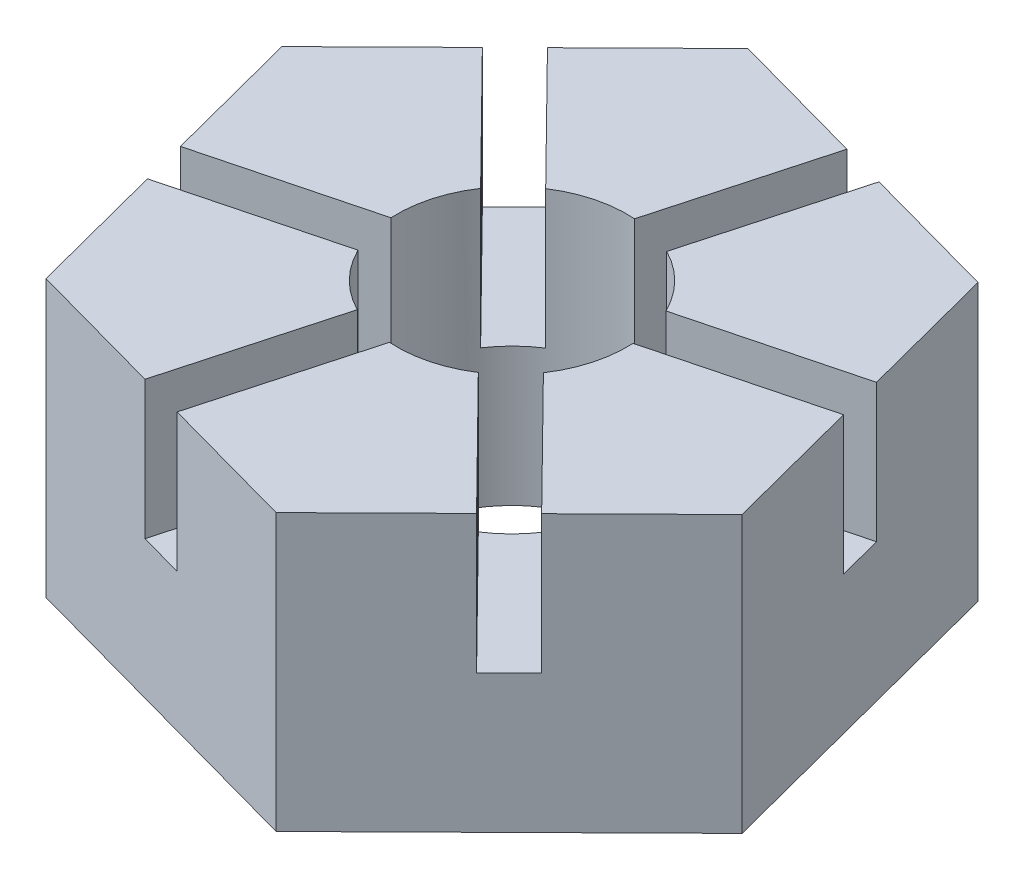
from build123d import *

# Parameters (mm, degrees)
BOSS_EXTRUDE1_DEPTH   = 60
BOSS_EXTRUDE1_2_DEPTH = 60
BOSS_EXTRUDE1_3_DEPTH = 60
BOSS_EXTRUDE1_4_DEPTH = 60
BOSS_EXTRUDE1_5_DEPTH = 60
BOSS_EXTRUDE1_6_DEPTH = 60
BOSS_EXTRUDE2_DEPTH   = 30


with BuildPart() as part:
    # Sketch2 → Boss-Extrude1 (new body)
    with BuildSketch(Plane(origin=(0, 0, 0), x_dir=(1, 0, 0), z_dir=(0, 1, 0))):
        with BuildLine():
            Line((22.445988761, 11.008069246), (58.740707334, 20.453692353))
            Line((58.740707334, 20.453692353), (50.984749422, 50.255888195))
            Line((50.984749422, 50.255888195), (21.297311778, 58.440129534))
            Line((21.297311778, 58.440129534), (11.330102056, 22.285169674))
            ThreePointArc((11.330102056, 22.285169674), (17.804474894, 17.54994797), (22.445988761, 11.008069246))
        make_face()
    extrude(amount=BOSS_EXTRUDE1_DEPTH)



with BuildPart() as body_2:
    # Sketch2 → Boss-Extrude1 2 (new body)
    with BuildSketch(Plane(origin=(0, 0, 0), x_dir=(1, 0, 0), z_dir=(0, 1, 0))):
        with BuildLine():
            Line((69.015250578, -19.026144108), (61.259292666, 10.776051735))
            Line((61.259292666, 10.776051735), (24.964574093, 1.330428629))
            ThreePointArc((24.964574093, 1.330428629), (24.100938224, -6.644153574), (20.756261995, -13.934761857))
            Line((20.756261995, -13.934761857), (47.083770846, -40.644098611))
            Line((47.083770846, -40.644098611), (69.015250578, -19.026144108))
        make_face()
    extrude(amount=BOSS_EXTRUDE1_2_DEPTH)


with BuildPart() as body_3:
    # Sketch2 → Boss-Extrude1 3 (new body)
    with BuildSketch(Plane(origin=(0, 0, 0), x_dir=(1, 0, 0), z_dir=(0, 1, 0))):
        with BuildLine():
            ThreePointArc((-13.634472037, 20.954741045), (-6.29646333, 24.194101544), (1.689726767, 24.942831103))
            Line((1.689726767, 24.942831103), (11.656936488, 61.097790964))
            Line((11.656936488, 61.097790964), (-18.030501156, 69.282032303))
            Line((-18.030501156, 69.282032303), (-39.961980888, 47.664077799))
            Line((-39.961980888, 47.664077799), (-13.634472037, 20.954741045))
        make_face()
    extrude(amount=BOSS_EXTRUDE1_3_DEPTH)


with BuildPart() as body_4:
    # Sketch2 → Boss-Extrude1 4 (new body)
    with BuildSketch(Plane(origin=(0, 0, 0), x_dir=(1, 0, 0), z_dir=(0, 1, 0))):
        with BuildLine():
            Line((18.030501156, -69.282032303), (39.961980888, -47.664077799))
            Line((39.961980888, -47.664077799), (13.634472037, -20.954741045))
            ThreePointArc((13.634472037, -20.954741045), (6.29646333, -24.194101544), (-1.689726767, -24.942831103))
            Line((-1.689726767, -24.942831103), (-11.656936488, -61.097790964))
            Line((-11.656936488, -61.097790964), (18.030501156, -69.282032303))
        make_face()
    extrude(amount=BOSS_EXTRUDE1_4_DEPTH)


with BuildPart() as body_5:
    # Sketch2 → Boss-Extrude1 5 (new body)
    with BuildSketch(Plane(origin=(0, 0, 0), x_dir=(1, 0, 0), z_dir=(0, 1, 0))):
        with BuildLine():
            ThreePointArc((-24.964574093, -1.330428629), (-24.100938224, 6.644153574), (-20.756261995, 13.934761857))
            Line((-20.756261995, 13.934761857), (-47.083770846, 40.644098611))
            Line((-47.083770846, 40.644098611), (-69.015250578, 19.026144108))
            Line((-69.015250578, 19.026144108), (-61.259292666, -10.776051735))
            Line((-61.259292666, -10.776051735), (-24.964574093, -1.330428629))
        make_face()
    extrude(amount=BOSS_EXTRUDE1_5_DEPTH)


with BuildPart() as body_6:
    # Sketch2 → Boss-Extrude1 6 (new body)
    with BuildSketch(Plane(origin=(0, 0, 0), x_dir=(1, 0, 0), z_dir=(0, 1, 0))):
        with BuildLine():
            Line((-21.297311778, -58.440129534), (-11.330102056, -22.285169674))
            ThreePointArc((-11.330102056, -22.285169674), (-17.804474894, -17.54994797), (-22.445988761, -11.008069246))
            Line((-22.445988761, -11.008069246), (-58.740707334, -20.453692353))
            Line((-58.740707334, -20.453692353), (-50.984749422, -50.255888195))
            Line((-50.984749422, -50.255888195), (-21.297311778, -58.440129534))
        make_face()
    extrude(amount=BOSS_EXTRUDE1_6_DEPTH)


with BuildPart() as part_1:
    add(part.part)

    add(body_2.part)  # Boss-Extrude2 merges body 2

    add(body_3.part)  # Boss-Extrude2 merges body 3

    add(body_4.part)  # Boss-Extrude2 merges body 4

    add(body_5.part)  # Boss-Extrude2 merges body 5

    add(body_6.part)  # Boss-Extrude2 merges body 6
    # Sketch2<3> → Boss-Extrude2 (add)
    with BuildSketch(Plane(origin=(0, 0, 0), x_dir=(1, 0, 0), z_dir=(0, 1, 0))):
        with BuildLine():
            Line((61.259292666, 10.776051735), (58.740707334, 20.453692353))
            Line((58.740707334, 20.453692353), (22.445988761, 11.008069246))
            ThreePointArc((22.445988761, 11.008069246), (24.194101544, 6.29646333), (24.964574093, 1.330428629))
            Line((24.964574093, 1.330428629), (61.259292666, 10.776051735))
        make_face()
        with BuildLine():
            ThreePointArc((1.689726767, 24.942831103), (6.644153574, 24.100938224), (11.330102056, 22.285169674))
            Line((11.330102056, 22.285169674), (21.297311778, 58.440129534))
            Line((21.297311778, 58.440129534), (11.656936488, 61.097790964))
            Line((11.656936488, 61.097790964), (1.689726767, 24.942831103))
        make_face()
        with BuildLine():
            Line((39.961980888, -47.664077799), (47.083770846, -40.644098611))
            Line((47.083770846, -40.644098611), (20.756261995, -13.934761857))
            ThreePointArc((20.756261995, -13.934761857), (17.54994797, -17.804474894), (13.634472037, -20.954741045))
            Line((13.634472037, -20.954741045), (39.961980888, -47.664077799))
        make_face()
        with BuildLine():
            ThreePointArc((-20.756261995, 13.934761857), (-17.54994797, 17.804474894), (-13.634472037, 20.954741045))
            Line((-13.634472037, 20.954741045), (-39.961980888, 47.664077799))
            Line((-39.961980888, 47.664077799), (-47.083770846, 40.644098611))
            Line((-47.083770846, 40.644098611), (-20.756261995, 13.934761857))
        make_face()
        with BuildLine():
            Line((-11.656936488, -61.097790964), (-1.689726767, -24.942831103))
            ThreePointArc((-1.689726767, -24.942831103), (-6.644153574, -24.100938224), (-11.330102056, -22.285169674))
            Line((-11.330102056, -22.285169674), (-21.297311778, -58.440129534))
            Line((-21.297311778, -58.440129534), (-11.656936488, -61.097790964))
        make_face()
        with BuildLine():
            ThreePointArc((-22.445988761, -11.008069246), (-24.194101544, -6.29646333), (-24.964574093, -1.330428629))
            Line((-24.964574093, -1.330428629), (-61.259292666, -10.776051735))
            Line((-61.259292666, -10.776051735), (-58.740707334, -20.453692353))
            Line((-58.740707334, -20.453692353), (-22.445988761, -11.008069246))
        make_face()
    extrude(amount=BOSS_EXTRUDE2_DEPTH)


solid = part_1.part
